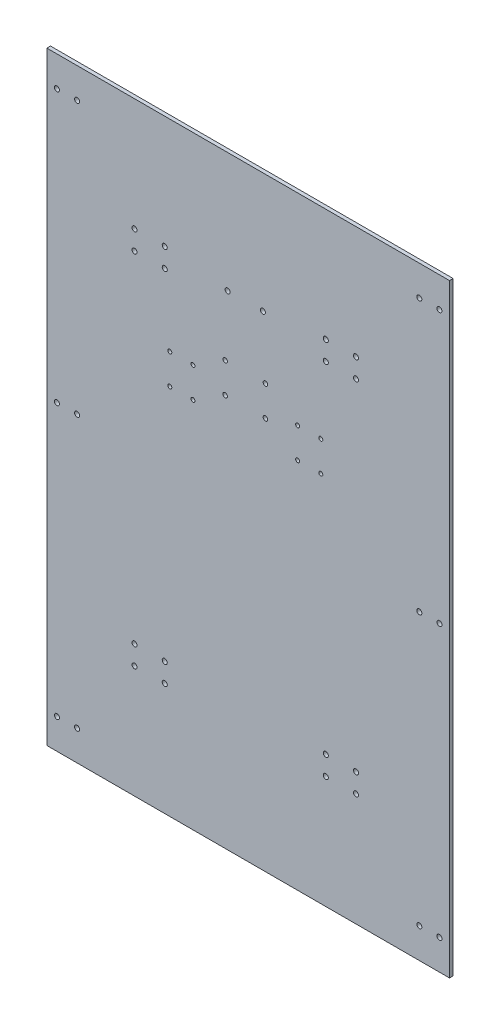
from build123d import *

# Parameters (mm, degrees)
SKETCH_1_W          = 400
SKETCH_1_H          = 600
EXTRUDE_1_DEPTH     = 3.6
SKETCH_4_R          = 2.5
CUT_EXTRUDE_3_DEPTH = 3.6
SKETCH_5_R          = 2
CUT_EXTRUDE_4_DEPTH = 10
SKETCH_6_R          = 2
CUT_EXTRUDE_5_DEPTH = 10
SKETCH_7_R          = 2.5
CUT_EXTRUDE_6_DEPTH = 10
SKETCH_8_R          = 2.25
CUT_EXTRUDE_7_DEPTH = 376.017279602
SKETCH_9_R          = 2.5
CUT_EXTRUDE_8_DEPTH = 376.017279602


with BuildPart() as part:
    # 草图1 → 凸台-拉伸1 (new body)
    with BuildSketch(Plane.XY):
        with Locations((-25, 0)):
            Rectangle(SKETCH_1_W, SKETCH_1_H)
    extrude(amount=EXTRUDE_1_DEPTH)

    # 草图4 → 切除-拉伸3 (cut)
    with BuildSketch(Plane.XY.offset(3.6)):
        with Locations((-195, 270)):
            Circle(SKETCH_4_R)
        with Locations((-195, -270)):
            Circle(SKETCH_4_R)
        with Locations((-195, 0)):
            Circle(SKETCH_4_R)
        with Locations(Location((-215, -270, 0), (0, 0, 180))):
            Circle(SKETCH_4_R)
        with Locations(Location((-215, 0, 0), (0, 0, 180))):
            Circle(SKETCH_4_R)
        with Locations(Location((-215, 270, 0), (0, 0, 180))):
            Circle(SKETCH_4_R)
    cut_extrude_3 = extrude(amount=-CUT_EXTRUDE_3_DEPTH, mode=Mode.SUBTRACT)

    # 草图5 → 切除-拉伸4 (cut)
    with BuildSketch(Plane.XY.offset(3.6)):
        with Locations((-102.883860642, 69.955951215)):
            Circle(SKETCH_5_R)
        with Locations((-102.883860642, 99.955951215)):
            Circle(SKETCH_5_R)
        with Locations((-79.883860642, 69.955951215)):
            Circle(SKETCH_5_R)
        with Locations((-79.883860642, 99.955951215)):
            Circle(SKETCH_5_R)
    extrude(amount=-CUT_EXTRUDE_4_DEPTH, mode=Mode.SUBTRACT)

    # 草图6 → 切除-拉伸5 (cut)
    with BuildSketch(Plane.XY.offset(3.6)):
        with Locations((24.116139358, 69.955951215)):
            Circle(SKETCH_6_R)
        with Locations((24.116139358, 99.955951215)):
            Circle(SKETCH_6_R)
        with Locations((47.116139358, 69.955951215)):
            Circle(SKETCH_6_R)
        with Locations((47.116139358, 99.955951215)):
            Circle(SKETCH_6_R)
    extrude(amount=-CUT_EXTRUDE_5_DEPTH, mode=Mode.SUBTRACT)

    # 草图7 → 切除-拉伸6 (cut)
    with BuildSketch(Plane.XY.offset(3.6)):
        with Locations((-45.383860642, 180.955951215)):
            Circle(SKETCH_7_R)
        with Locations((-10.383860642, 180.955951215)):
            Circle(SKETCH_7_R)
    extrude(amount=-CUT_EXTRUDE_6_DEPTH, mode=Mode.SUBTRACT)

    # 草图8 → 切除-拉伸7 (cut, through all)
    with BuildSketch(Plane.XY.offset(3.6)):
        with Locations((-47.883860642, 89.955951215)):
            Circle(SKETCH_8_R)
        with Locations((-47.883860642, 119.955951215)):
            Circle(SKETCH_8_R)
        with Locations((-7.883860642, 89.955951215)):
            Circle(SKETCH_8_R)
        with Locations((-7.883860642, 119.955951215)):
            Circle(SKETCH_8_R)
    extrude(amount=-CUT_EXTRUDE_7_DEPTH, mode=Mode.SUBTRACT)

    # 草图9 → 切除-拉伸8 (cut, through all)
    with BuildSketch(Plane.XY.offset(3.6)):
        with Locations((-137.883860642, -188.044048785)):
            Circle(SKETCH_9_R)
        with Locations((-137.883860642, -169.044048785)):
            Circle(SKETCH_9_R)
        with Locations((-107.883860642, -188.044048785)):
            Circle(SKETCH_9_R)
        with Locations((-107.883860642, -169.044048785)):
            Circle(SKETCH_9_R)
        with Locations((52.116139358, -188.044048785)):
            Circle(SKETCH_9_R)
        with Locations((52.116139358, -169.044048785)):
            Circle(SKETCH_9_R)
        with Locations((82.116139358, -169.044048785)):
            Circle(SKETCH_9_R)
        with Locations((82.116139358, -188.044048785)):
            Circle(SKETCH_9_R)
        with Locations((82.116139358, 168.955951215)):
            Circle(SKETCH_9_R)
        with Locations((82.116139358, 187.955951215)):
            Circle(SKETCH_9_R)
        with Locations((52.116139358, 168.955951215)):
            Circle(SKETCH_9_R)
        with Locations((52.116139358, 187.955951215)):
            Circle(SKETCH_9_R)
        with Locations((-107.883860642, 168.955951215)):
            Circle(SKETCH_9_R)
        with Locations((-107.883860642, 187.955951215)):
            Circle(SKETCH_9_R)
        with Locations((-137.883860642, 168.955951215)):
            Circle(SKETCH_9_R)
        with Locations((-137.883860642, 187.955951215)):
            Circle(SKETCH_9_R)
    extrude(amount=-CUT_EXTRUDE_8_DEPTH, mode=Mode.SUBTRACT)

    # 镜向1: 切除-拉伸3 across plane
    add(cut_extrude_3.mirror(Plane.ZY.offset(25)), mode=Mode.SUBTRACT)


solid = part.part
